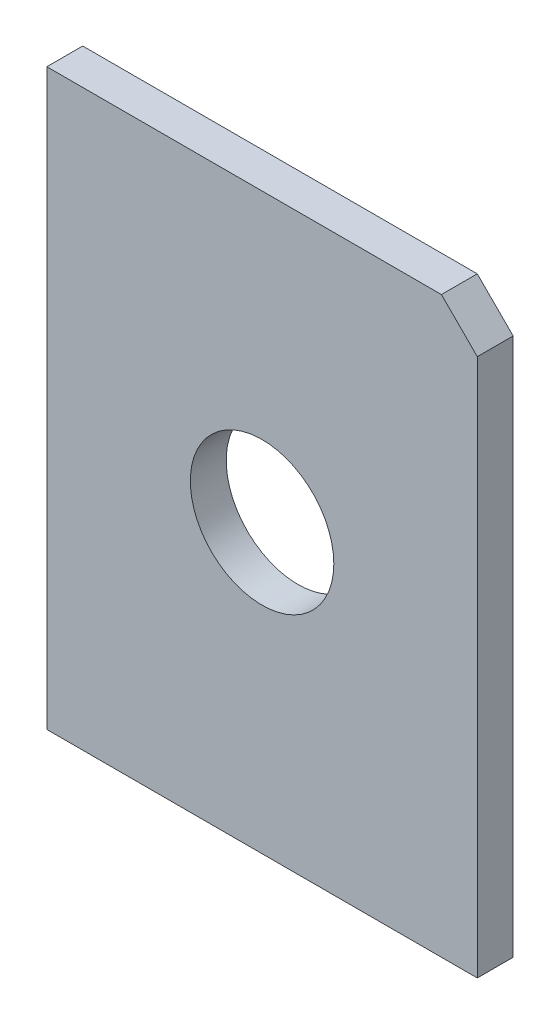
from build123d import *

# Parameters (mm, degrees)
SKETCH1_R      = 10
EXTRUDE1_DEPTH = 5


with BuildPart() as part:
    # Sketch1 → Extrude1 (new body)
    with BuildSketch(Plane.XY):
        Polygon((55, 80), (60, 75), (60, 0), (0, 0), (0, 80), align=None)
        with Locations((30, 40)):
            Circle(SKETCH1_R, mode=Mode.SUBTRACT)
    extrude(amount=-EXTRUDE1_DEPTH)


solid = part.part
